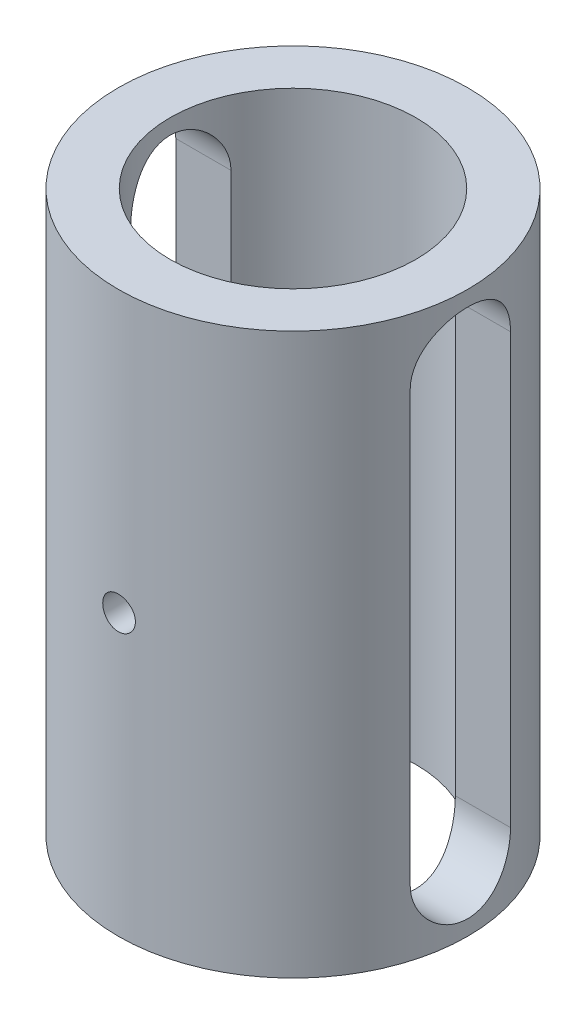
from build123d import *

# Parameters (mm, degrees)
SKETCH1_R           = 11.5
SKETCH1_R_2         = 8.0883
BOSS_EXTRUDE1_DEPTH = 36.88
CUT_EXTRUDE1_DEPTH  = 55.88
SKETCH3_R           = 1.075360457
CUT_EXTRUDE2_DEPTH  = 41.306753925


with BuildPart() as part:
    # Sketch1 → Boss-Extrude1 (new body)
    with BuildSketch(Plane(origin=(0, 0, 0), x_dir=(1, 0, 0), z_dir=(0, 1, 0))):
        with Locations(Location((0, 0, 0), (0, 0, 270))):
            Circle(SKETCH1_R)
        with Locations(Location((0, 0, 0), (0, 0, 270))):
            Circle(SKETCH1_R_2, mode=Mode.SUBTRACT)
    extrude(amount=BOSS_EXTRUDE1_DEPTH)

    # Sketch2 → Cut-Extrude1 (cut)
    with BuildSketch(Plane.ZY.offset(11.5)):
        with BuildLine():
            Line((3.302, 32.573327327), (3.302, 4.306672673))
            ThreePointArc((3.302, 4.306672673), (0, 1.004672673), (-3.302, 4.306672673))
            Line((-3.302, 4.306672673), (-3.302, 32.573327327))
            ThreePointArc((-3.302, 32.573327327), (0, 35.875327327), (3.302, 32.573327327))
        make_face()
    extrude(amount=-CUT_EXTRUDE1_DEPTH, mode=Mode.SUBTRACT)

    # Sketch3 → Cut-Extrude2 (cut, through all)
    with BuildSketch(Plane.XY):
        with Locations(Location((0, 18.44, 0), (0, 0, 270.000000024))):
            Circle(SKETCH3_R)
    extrude(amount=CUT_EXTRUDE2_DEPTH, mode=Mode.SUBTRACT)


solid = part.part
